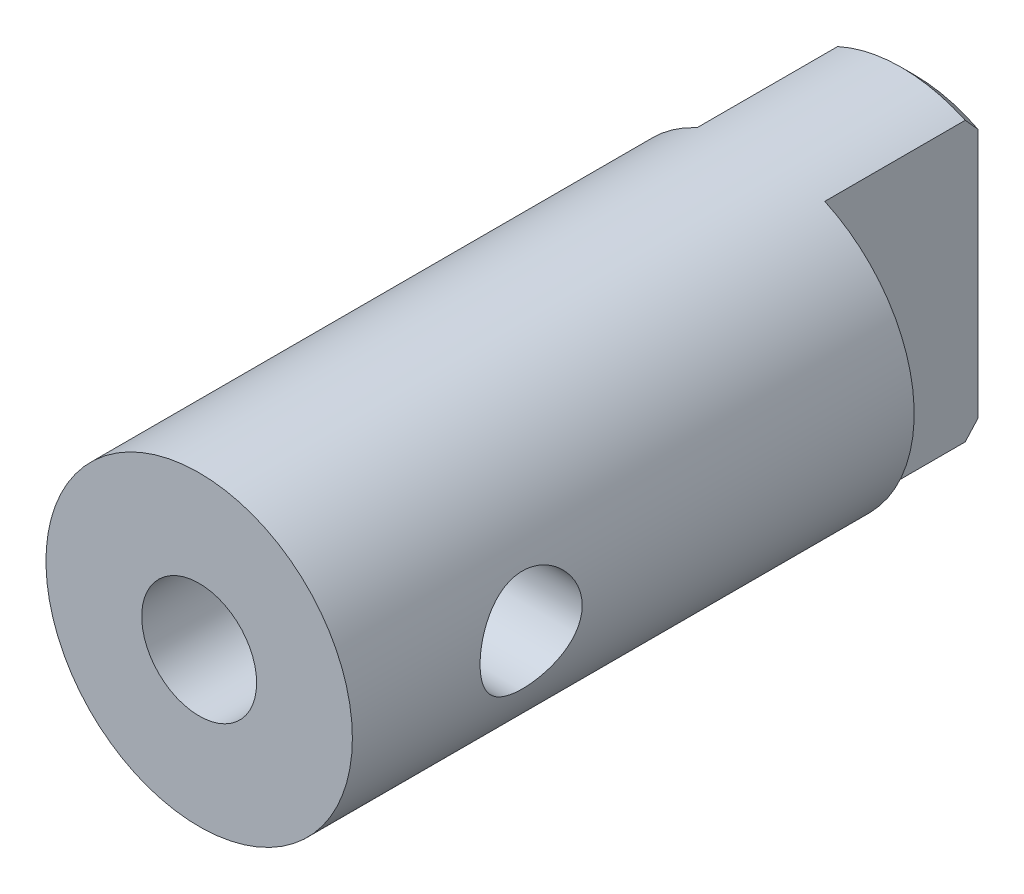
from build123d import *

# Parameters (mm, degrees)
ESQUISSE1_R                  = 6
CYLINDRE_EXTERIEUR_DEPTH     = 28
TENON_DEPTH                  = 10
TENON_DEPTH_BACK             = 10
ESQUISSE3_W                  = 6
ESQUISSE3_H                  = 7
ESQUISSE3_H_2                = 9
CHANFREIN1_SIZE              = 0.5
PER_AGE1_D                   = 4.5
PER_AGE1_DEPTH               = 18.5
PER_AGE1_TIP                 = 1.351936393
ENL_V_MAT_EXTRU_2_DEPTH      = 10
ENL_V_MAT_EXTRU_2_DEPTH_BACK = 30.257477677
ESQUISSE6_R                  = 2


with BuildPart() as part:
    # Esquisse1 → Cylindre exterieur (new body)
    with BuildSketch(Plane.XY):
        with Locations(Location((0, 0, 0), (0, 0, 245.375681648))):
            Circle(ESQUISSE1_R)
    extrude(amount=CYLINDRE_EXTERIEUR_DEPTH)

    # Esquisse3 → Tenon (cut, two sides: drawn at the far end of the back side and taken through both)
    with BuildSketch(Plane(origin=(0, 0, 0), x_dir=(1, 0, 0), z_dir=(0, 1, 0)).offset(-TENON_DEPTH_BACK)):
        with Locations((5.5, -2.5)):
            Rectangle(ESQUISSE3_W, ESQUISSE3_H)
        with Locations((-5.5, -1.5)):
            Rectangle(ESQUISSE3_W, ESQUISSE3_H_2)
    extrude(amount=TENON_DEPTH + TENON_DEPTH_BACK, mode=Mode.SUBTRACT)

    # Chanfrein1
    chanfrein1_edges = [part.edges().sort_by_distance(p)[0] for p in [
        (0, -6, 0),
        (0, 6, 0),
    ]]
    chamfer(chanfrein1_edges, length=CHANFREIN1_SIZE)

    # Perçage1
    with Locations(Plane.XY.offset(28)):
        with Locations((0, 0)):
            Hole(PER_AGE1_D / 2, depth=PER_AGE1_DEPTH)
            with Locations((0, 0, -(PER_AGE1_DEPTH + PER_AGE1_TIP / 2))):  # 118° drill point
                Cone(0, PER_AGE1_D / 2, PER_AGE1_TIP, mode=Mode.SUBTRACT)

    # Esquisse6 → Enlèv. mat.-Extru.2 (cut, two sides: drawn at the far end of the back side and taken through both)
    with BuildSketch(Plane(origin=(0, 0, 0), x_dir=(0, 0, -1), z_dir=(1, 0, 0)).offset(-ENL_V_MAT_EXTRU_2_DEPTH_BACK)):
        with Locations((-21, 0)):
            Circle(ESQUISSE6_R)
    extrude(amount=ENL_V_MAT_EXTRU_2_DEPTH + ENL_V_MAT_EXTRU_2_DEPTH_BACK, mode=Mode.SUBTRACT)


solid = part.part
